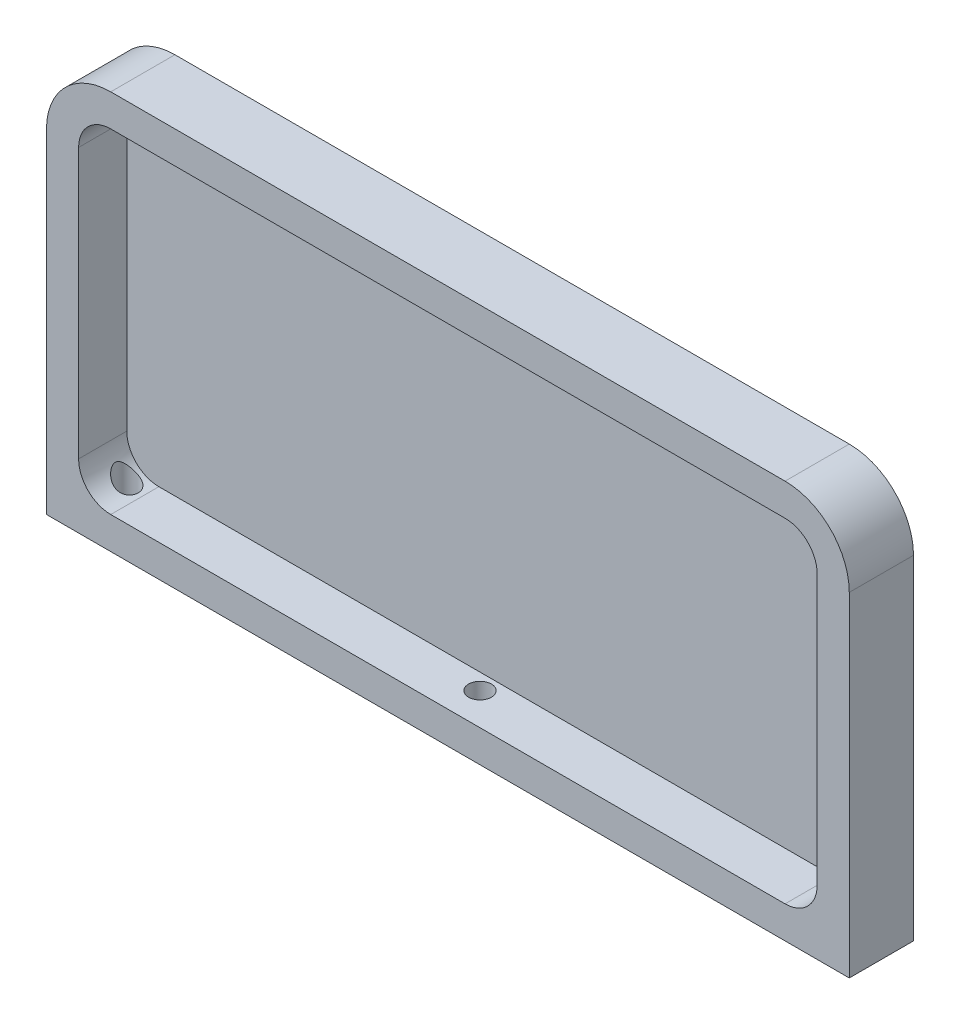
from build123d import *

# Parameters (mm, degrees)
SKETCH1_W                 = 79.375
SKETCH1_H                 = 39.37
BOSS_EXTRUDE1_DEPTH       = 6.35
FILLET1_R                 = 6.35
F_4_40_TAPPED_HOLE1_D     = 2.2606
F_4_40_TAPPED_HOLE1_DEPTH = 7.62
F_4_40_TAPPED_HOLE1_TIP   = 0.679152758
CUT_EXTRUDE1_DEPTH        = 4.7625


with BuildPart() as part:
    # Sketch1 → Boss-Extrude1 (new body)
    with BuildSketch(Plane.XY):
        Rectangle(SKETCH1_W, SKETCH1_H)
    extrude(amount=BOSS_EXTRUDE1_DEPTH)

    # Fillet1
    fillet1_edges = [part.edges().sort_by_distance(p)[0] for p in [
        (-39.6875, 19.685, 3.175),
        (39.6875, 19.685, 3.175),
    ]]
    fillet(fillet1_edges, radius=FILLET1_R)

    # #4-40 Tapped Hole1
    with Locations(Plane.XZ.offset(19.685)):
        with Locations((0, 3.175), (-34.925, 3.175), (34.925, 3.175)):
            Hole(F_4_40_TAPPED_HOLE1_D / 2, depth=F_4_40_TAPPED_HOLE1_DEPTH)
            with Locations((0, 0, -(F_4_40_TAPPED_HOLE1_DEPTH + F_4_40_TAPPED_HOLE1_TIP / 2))):  # 118° drill point
                Cone(0, F_4_40_TAPPED_HOLE1_D / 2, F_4_40_TAPPED_HOLE1_TIP, mode=Mode.SUBTRACT)

    # Sketch5 → Cut-Extrude1 (cut)
    with BuildSketch(Plane.XY.offset(6.35)):
        with BuildLine():
            Line((36.5125, -13.335), (36.5125, 13.335))
            ThreePointArc((36.5125, 13.335), (35.58256403, 15.58006403), (33.3375, 16.51))
            Line((33.3375, 16.51), (-33.3375, 16.51))
            ThreePointArc((-33.3375, 16.51), (-35.58256403, 15.58006403), (-36.5125, 13.335))
            Line((-36.5125, 13.335), (-36.5125, -13.335))
            ThreePointArc((-36.5125, -13.335), (-35.58256403, -15.58006403), (-33.3375, -16.51))
            Line((-33.3375, -16.51), (33.3375, -16.51))
            ThreePointArc((33.3375, -16.51), (35.58256403, -15.58006403), (36.5125, -13.335))
        make_face()
    extrude(amount=-CUT_EXTRUDE1_DEPTH, mode=Mode.SUBTRACT)


solid = part.part
